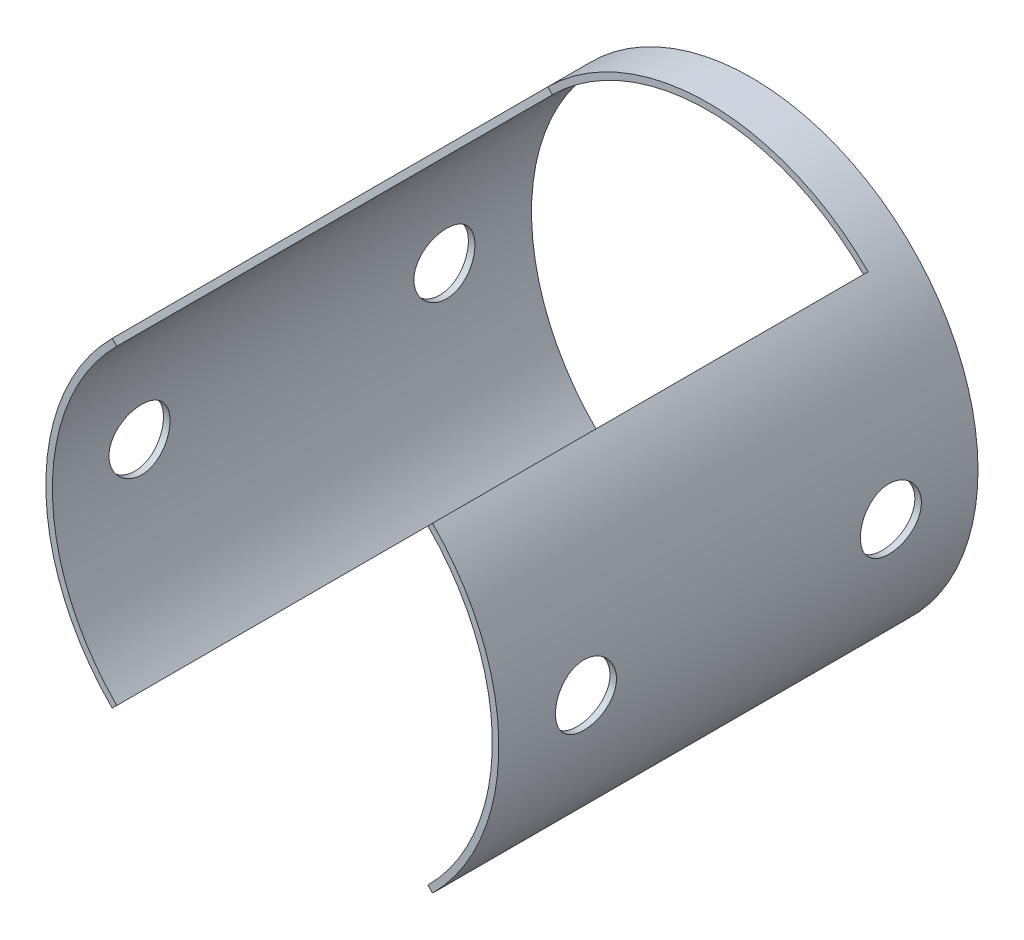
from build123d import *
from build123d.topology import SkipClean

# Parameters (mm, degrees)
SKETCH2_R               = 26
SKETCH2_R_2             = 25.25
BOSS_EXTRUDE1_DEPTH     = 5
BOSS_EXTRUDE2_DEPTH     = 50
CUT_EXTRUDE1_DEPTH      = 67.158899628
CUT_EXTRUDE1_DEPTH_BACK = 67.158899628
SKETCH4_R               = 3.5


with BuildPart() as part:
    # Sketch2 → Boss-Extrude1 (new body)
    with BuildSketch(Plane.XY):
        Circle(SKETCH2_R)
        Circle(SKETCH2_R_2, mode=Mode.SUBTRACT)
    extrude(amount=BOSS_EXTRUDE1_DEPTH)

    # Sketch3 → Boss-Extrude2 (add)
    with SkipClean():  # the faces are left unmerged after this step: merging them gives an invalid solid
        with BuildSketch(Plane.XY.offset(5)):
            with BuildLine():
                Line((-17.854446225, 17.854446225), (-18.384776311, 18.384776311))
                ThreePointArc((-18.384776311, 18.384776311), (-26, 0), (-18.384776311, -18.384776311))
                Line((-18.384776311, -18.384776311), (-17.854446225, -17.854446225))
                ThreePointArc((-17.854446225, -17.854446225), (-25.25, 0), (-17.854446225, 17.854446225))
            make_face()
            with BuildLine():
                Line((17.854446225, -17.854446225), (18.384776311, -18.384776311))
                ThreePointArc((18.384776311, -18.384776311), (26, 0), (18.384776311, 18.384776311))
                Line((18.384776311, 18.384776311), (17.854446225, 17.854446225))
                ThreePointArc((17.854446225, 17.854446225), (25.25, 0), (17.854446225, -17.854446225))
            make_face()
        extrude(amount=BOSS_EXTRUDE2_DEPTH)

    # Sketch4 → Cut-Extrude1 (cut, two sides: drawn at the far end of the back side and taken through both)
    with SkipClean():  # the faces are left unmerged after this step: merging them gives an invalid solid
        with BuildSketch(Plane(origin=(0, 0, 0), x_dir=(0, 0, -1), z_dir=(1, 0, 0)).offset(-CUT_EXTRUDE1_DEPTH_BACK)):
            with Locations((-45, 0)):
                Circle(SKETCH4_R)
            with Locations((-10, 0)):
                Circle(SKETCH4_R)
        extrude(amount=CUT_EXTRUDE1_DEPTH + CUT_EXTRUDE1_DEPTH_BACK, mode=Mode.SUBTRACT)


solid = part.part
